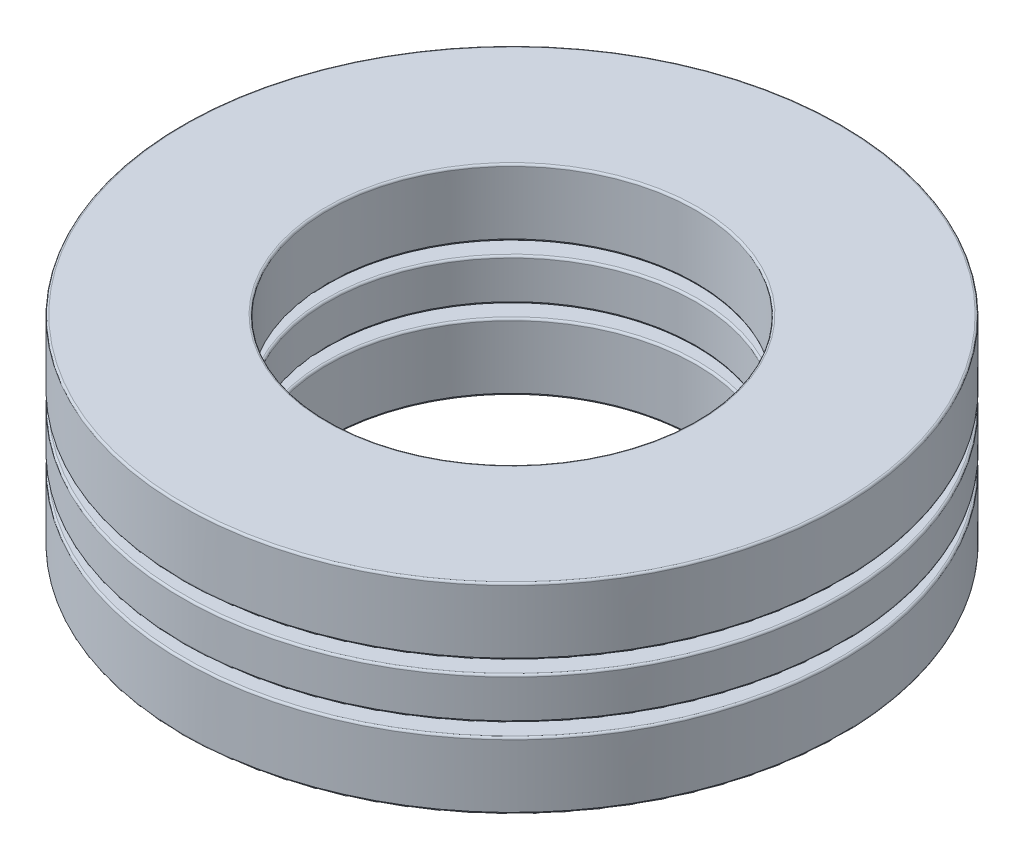
from build123d import *

# Parameters (mm, degrees)
SKETCH1_W         = 6.3119
SKETCH1_H         = 1.80975
CIRPATTERN1_COUNT = 6
CIRPATTERN1_ANGLE = 300
CIRPATTERN2_COUNT = 6
SKETCH4_W         = 6.3119
SKETCH4_H         = 2.8956
FILLET1_R         = 0.086868
FILLET2_R         = 0.086868
FILLET3_R         = 0.086868


with BuildPart() as part:
    # Sketch1 → Revolve1 (revolve)
    with BuildSketch(Plane(origin=(0, 0, 0), x_dir=(0, 0, -1), z_dir=(1, 0, 0)), mode=Mode.PRIVATE) as revolve1_sk:
        with Locations((-11.13155, 0)):
            Rectangle(SKETCH1_W, SKETCH1_H)
    revolve(revolve1_sk.sketch.rotate(Axis((0, -4.3434, 0), (0, 1, 0)), 180), axis=Axis((0, -4.3434, 0), (0, 1, 0)))

    # Sketch3 → Cut-Revolve1 (revolve, cut)
    with BuildSketch(Plane(origin=(0, 0, 0), x_dir=(0, 0, -1), z_dir=(1, 0, 0))):
        with BuildLine():
            Line((-11.13155, 1.4478), (-11.13155, -1.4478))
            ThreePointArc((-11.13155, -1.4478), (-12.57935, 0), (-11.13155, 1.4478))
        make_face()
    cut_revolve1 = revolve(axis=Axis((0, 1.4478, 11.13155), (0, -1, 0)), mode=Mode.SUBTRACT)

    # CirPattern2: Cut-Revolve1 ×6 about axis
    cirpattern2_axis = Axis((0, 0, 0), (0, 1, 0))
    for i in range(1, CIRPATTERN2_COUNT):
        add(cut_revolve1.rotate(cirpattern2_axis, i * 360 / CIRPATTERN2_COUNT), mode=Mode.SUBTRACT)

    # Fillet2
    fillet2_edges = [part.edges().sort_by_distance(p)[0] for p in [
        (0, 0.904875, 14.2875),
        (0, 0.904875, 7.9756),
        (0, -0.904875, 7.9756),
        (0, -0.904875, 14.2875),
    ]]
    fillet(fillet2_edges, radius=FILLET2_R)


with BuildPart() as body_2:
    # Sketch2 → Revolve2 (revolve)
    with BuildSketch(Plane(origin=(0, 0, 0), x_dir=(0, 0, -1), z_dir=(1, 0, 0))):
        with BuildLine():
            Line((-11.13155, 1.4478), (-11.13155, -1.4478))
            ThreePointArc((-11.13155, -1.4478), (-12.57935, 0), (-11.13155, 1.4478))
        make_face()
    revolve(axis=Axis((0, 1.4478, 11.13155), (0, -1, 0)))


with BuildPart() as cirpattern1_1:
    # CirPattern1: pattern copy
    add(body_2.part.rotate(Axis((0, 4.3434, 0), (0, -1, 0)), 1 * CIRPATTERN1_ANGLE / (CIRPATTERN1_COUNT - 1)))


with BuildPart() as cirpattern1_2:
    # CirPattern1: pattern copy
    add(body_2.part.rotate(Axis((0, 4.3434, 0), (0, -1, 0)), 2 * CIRPATTERN1_ANGLE / (CIRPATTERN1_COUNT - 1)))


with BuildPart() as cirpattern1_3:
    # CirPattern1: pattern copy
    add(body_2.part.rotate(Axis((0, 4.3434, 0), (0, -1, 0)), 3 * CIRPATTERN1_ANGLE / (CIRPATTERN1_COUNT - 1)))


with BuildPart() as cirpattern1_4:
    # CirPattern1: pattern copy
    add(body_2.part.rotate(Axis((0, 4.3434, 0), (0, -1, 0)), 4 * CIRPATTERN1_ANGLE / (CIRPATTERN1_COUNT - 1)))


with BuildPart() as cirpattern1_5:
    # CirPattern1: pattern copy
    add(body_2.part.rotate(Axis((0, 4.3434, 0), (0, -1, 0)), 5 * CIRPATTERN1_ANGLE / (CIRPATTERN1_COUNT - 1)))


with BuildPart() as body_8:
    # Sketch4 → Revolve3 (revolve)
    with BuildSketch(Plane(origin=(0, 0, 0), x_dir=(0, 0, -1), z_dir=(1, 0, 0)), mode=Mode.PRIVATE) as revolve3_sk:
        with Locations((-11.13155, 2.8956)):
            Rectangle(SKETCH4_W, SKETCH4_H)
        with Locations((-11.13155, -2.8956)):
            Rectangle(SKETCH4_W, SKETCH4_H)
    revolve(revolve3_sk.sketch.rotate(Axis((0, -4.3434, 0), (0, 1, 0)), 180), axis=Axis((0, -4.3434, 0), (0, 1, 0)))

    # Fillet1
    fillet1_edges = [body_8.edges().sort_by_distance(p)[0] for p in [
        (0, 1.4478, 14.2875),
        (0, 1.4478, 7.9756),
        (0, 4.3434, 7.9756),
        (0, 4.3434, 14.2875),
    ]]
    fillet(fillet1_edges, radius=FILLET1_R)

    # Fillet3
    fillet3_edges = [body_8.edges().sort_by_distance(p)[0] for p in [
        (0, -4.3434, 14.2875),
        (0, -4.3434, 7.9756),
        (0, -1.4478, 7.9756),
        (0, -1.4478, 14.2875),
    ]]
    fillet(fillet3_edges, radius=FILLET3_R)


solid = Compound([part.part, body_2.part, cirpattern1_1.part, cirpattern1_2.part, cirpattern1_3.part, cirpattern1_4.part, cirpattern1_5.part, body_8.part])
